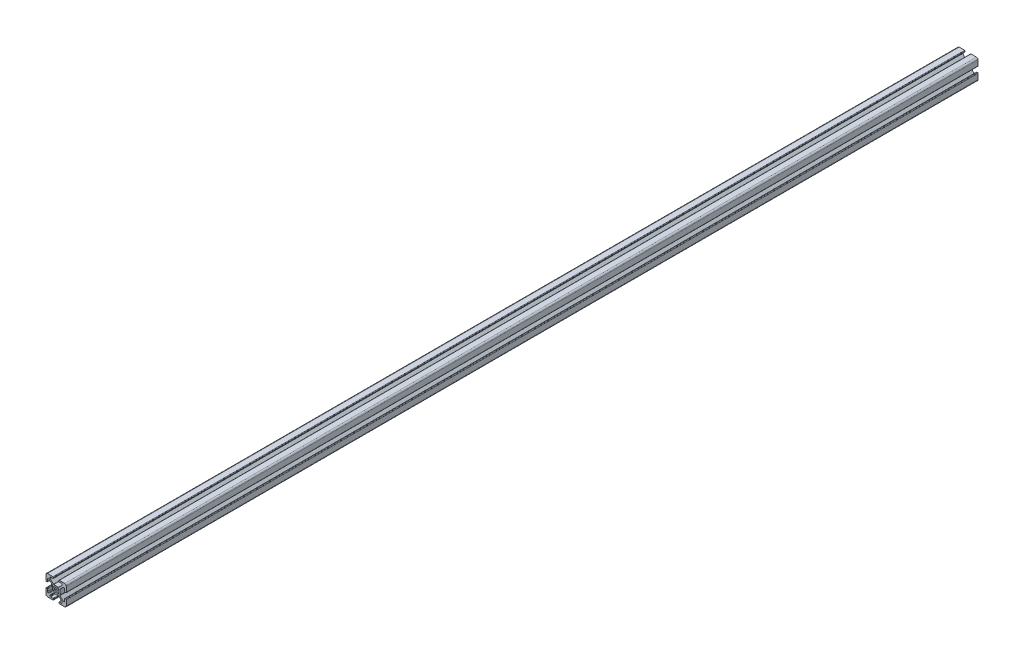
from build123d import *

# Parameters (mm, degrees)
BOSS_EXTRUDE1_DEPTH = 900


with BuildPart() as part:
    # Sketch2 → Boss-Extrude1 (new body)
    with BuildSketch(Plane.XY):
        with BuildLine():
            Line((-10, -3.138), (-10, -8.5))
            ThreePointArc((-10, -8.5), (-9.560660172, -9.560660172), (-8.5, -10))
            Line((-8.5, -10), (-3.138, -10))
            ThreePointArc((-3.138, -10), (-2.778789755, -9.851210245), (-2.63, -9.492))
            Line((-2.63, -9.492), (-2.63, -9.008))
            ThreePointArc((-2.63, -9.008), (-2.778789755, -8.648789755), (-3.138, -8.5))
            Line((-3.138, -8.5), (-5.487, -8.5))
            ThreePointArc((-5.487, -8.5), (-5.846210245, -8.351210245), (-5.995, -7.992))
            Line((-5.995, -7.992), (-5.995, -7.266240833))
            ThreePointArc((-5.995, -7.266240833), (-5.956330803, -7.07183765), (-5.846210245, -6.907030588))
            Line((-5.846210245, -6.907030588), (-2.742969412, -3.803789755))
            ThreePointArc((-2.742969412, -3.803789755), (-2.57816235, -3.693669197), (-2.383759167, -3.655))
            Line((-2.383759167, -3.655), (2.38407951, -3.655))
            ThreePointArc((2.38407951, -3.655), (2.578482694, -3.693669197), (2.743289755, -3.803789755))
            Line((2.743289755, -3.803789755), (5.846210245, -6.906710245))
            ThreePointArc((5.846210245, -6.906710245), (5.956330803, -7.071517306), (5.995, -7.26592049))
            Line((5.995, -7.26592049), (5.995, -7.992))
            ThreePointArc((5.995, -7.992), (5.846210245, -8.351210245), (5.487, -8.5))
            Line((5.487, -8.5), (3.138, -8.5))
            ThreePointArc((3.138, -8.5), (2.778789755, -8.648789755), (2.63, -9.008))
            Line((2.63, -9.008), (2.63, -9.492))
            ThreePointArc((2.63, -9.492), (2.778789755, -9.851210245), (3.138, -10))
            Line((3.138, -10), (8.5, -10))
            ThreePointArc((8.5, -10), (9.560660172, -9.560660172), (10, -8.5))
            Line((10, -8.5), (10, -3.138))
            ThreePointArc((10, -3.138), (9.851210245, -2.778789755), (9.492, -2.63))
            Line((9.492, -2.63), (9.008, -2.63))
            ThreePointArc((9.008, -2.63), (8.648789755, -2.778789755), (8.5, -3.138))
            Line((8.5, -3.138), (8.5, -5.487))
            ThreePointArc((8.5, -5.487), (8.351210245, -5.846210245), (7.992, -5.995))
            Line((7.992, -5.995), (7.266240833, -5.995))
            ThreePointArc((7.266240833, -5.995), (7.07183765, -5.956330803), (6.907030588, -5.846210245))
            Line((6.907030588, -5.846210245), (3.803789755, -2.742969412))
            ThreePointArc((3.803789755, -2.742969412), (3.693669197, -2.57816235), (3.655, -2.383759167))
            Line((3.655, -2.383759167), (3.655, 2.38407951))
            ThreePointArc((3.655, 2.38407951), (3.693669197, 2.578482694), (3.803789755, 2.743289755))
            Line((3.803789755, 2.743289755), (6.906710245, 5.846210245))
            ThreePointArc((6.906710245, 5.846210245), (7.071517306, 5.956330803), (7.26592049, 5.995))
            Line((7.26592049, 5.995), (7.992, 5.995))
            ThreePointArc((7.992, 5.995), (8.351210245, 5.846210245), (8.5, 5.487))
            Line((8.5, 5.487), (8.5, 3.138))
            ThreePointArc((8.5, 3.138), (8.648789755, 2.778789755), (9.008, 2.63))
            Line((9.008, 2.63), (9.492, 2.63))
            ThreePointArc((9.492, 2.63), (9.851210245, 2.778789755), (10, 3.138))
            Line((10, 3.138), (10, 8.5))
            ThreePointArc((10, 8.5), (9.560660172, 9.560660172), (8.5, 10))
            Line((8.5, 10), (3.138, 10))
            ThreePointArc((3.138, 10), (2.778789755, 9.851210245), (2.63, 9.492))
            Line((2.63, 9.492), (2.63, 9.008))
            ThreePointArc((2.63, 9.008), (2.778789755, 8.648789755), (3.138, 8.5))
            Line((3.138, 8.5), (5.487, 8.5))
            ThreePointArc((5.487, 8.5), (5.846210245, 8.351210245), (5.995, 7.992))
            Line((5.995, 7.992), (5.995, 7.266240833))
            ThreePointArc((5.995, 7.266240833), (5.956330803, 7.07183765), (5.846210245, 6.907030588))
            Line((5.846210245, 6.907030588), (2.742969412, 3.803789755))
            ThreePointArc((2.742969412, 3.803789755), (2.57816235, 3.693669197), (2.383759167, 3.655))
            Line((2.383759167, 3.655), (-2.38407951, 3.655))
            ThreePointArc((-2.38407951, 3.655), (-2.578482694, 3.693669197), (-2.743289755, 3.803789755))
            Line((-2.743289755, 3.803789755), (-5.846210245, 6.906710245))
            ThreePointArc((-5.846210245, 6.906710245), (-5.956330803, 7.071517306), (-5.995, 7.26592049))
            Line((-5.995, 7.26592049), (-5.995, 7.992))
            ThreePointArc((-5.995, 7.992), (-5.846210245, 8.351210245), (-5.487, 8.5))
            Line((-5.487, 8.5), (-3.138, 8.5))
            ThreePointArc((-3.138, 8.5), (-2.778789755, 8.648789755), (-2.63, 9.008))
            Line((-2.63, 9.008), (-2.63, 9.492))
            ThreePointArc((-2.63, 9.492), (-2.778789755, 9.851210245), (-3.138, 10))
            Line((-3.138, 10), (-8.5, 10))
            ThreePointArc((-8.5, 10), (-9.560660172, 9.560660172), (-10, 8.5))
            Line((-10, 8.5), (-10, 3.138))
            ThreePointArc((-10, 3.138), (-9.851210245, 2.778789755), (-9.492, 2.63))
            Line((-9.492, 2.63), (-9.008, 2.63))
            ThreePointArc((-9.008, 2.63), (-8.648789755, 2.778789755), (-8.5, 3.138))
            Line((-8.5, 3.138), (-8.5, 5.487))
            ThreePointArc((-8.5, 5.487), (-8.351210245, 5.846210245), (-7.992, 5.995))
            Line((-7.992, 5.995), (-7.266240833, 5.995))
            ThreePointArc((-7.266240833, 5.995), (-7.07183765, 5.956330803), (-6.907030588, 5.846210245))
            Line((-6.907030588, 5.846210245), (-3.803789755, 2.742969412))
            ThreePointArc((-3.803789755, 2.742969412), (-3.693669197, 2.57816235), (-3.655, 2.383759167))
            Line((-3.655, 2.383759167), (-3.655, -2.38407951))
            ThreePointArc((-3.655, -2.38407951), (-3.693669197, -2.578482694), (-3.803789755, -2.743289755))
            Line((-3.803789755, -2.743289755), (-6.906710245, -5.846210245))
            ThreePointArc((-6.906710245, -5.846210245), (-7.071517306, -5.956330803), (-7.26592049, -5.995))
            Line((-7.26592049, -5.995), (-7.992, -5.995))
            ThreePointArc((-7.992, -5.995), (-8.351210245, -5.846210245), (-8.5, -5.487))
            Line((-8.5, -5.487), (-8.5, -3.138))
            ThreePointArc((-8.5, -3.138), (-8.648789755, -2.778789755), (-9.008, -2.63))
            Line((-9.008, -2.63), (-9.492, -2.63))
            ThreePointArc((-9.492, -2.63), (-9.851210245, -2.778789755), (-10, -3.138))
        make_face()
        with BuildLine():
            Line((-2.124493037, 2.304493037), (-2.304493037, 2.124493037))
            ThreePointArc((-2.304493037, 2.124493037), (-2.506016078, 1.35638567), (-1.935777391, 0.803729988))
            ThreePointArc((-1.935777391, 0.803729988), (-2.096, 0), (-1.935777391, -0.803729988))
            ThreePointArc((-1.935777391, -0.803729988), (-2.506016078, -1.35638567), (-2.304493037, -2.124493037))
            Line((-2.304493037, -2.124493037), (-2.124493037, -2.304493037))
            ThreePointArc((-2.124493037, -2.304493037), (-1.35638567, -2.506016078), (-0.803729988, -1.935777391))
            ThreePointArc((-0.803729988, -1.935777391), (0, -2.096), (0.803729988, -1.935777391))
            ThreePointArc((0.803729988, -1.935777391), (1.35638567, -2.506016078), (2.124493037, -2.304493037))
            Line((2.124493037, -2.304493037), (2.304493037, -2.124493037))
            ThreePointArc((2.304493037, -2.124493037), (2.506016078, -1.35638567), (1.935777391, -0.803729988))
            ThreePointArc((1.935777391, -0.803729988), (2.096, 0), (1.935777391, 0.803729988))
            ThreePointArc((1.935777391, 0.803729988), (2.506016078, 1.35638567), (2.304493037, 2.124493037))
            Line((2.304493037, 2.124493037), (2.124493037, 2.304493037))
            ThreePointArc((2.124493037, 2.304493037), (1.35638567, 2.506016078), (0.803729988, 1.935777391))
            ThreePointArc((0.803729988, 1.935777391), (0, 2.096), (-0.803729988, 1.935777391))
            ThreePointArc((-0.803729988, 1.935777391), (-1.35638567, 2.506016078), (-2.124493037, 2.304493037))
        make_face(mode=Mode.SUBTRACT)
    extrude(amount=-BOSS_EXTRUDE1_DEPTH)


solid = part.part
